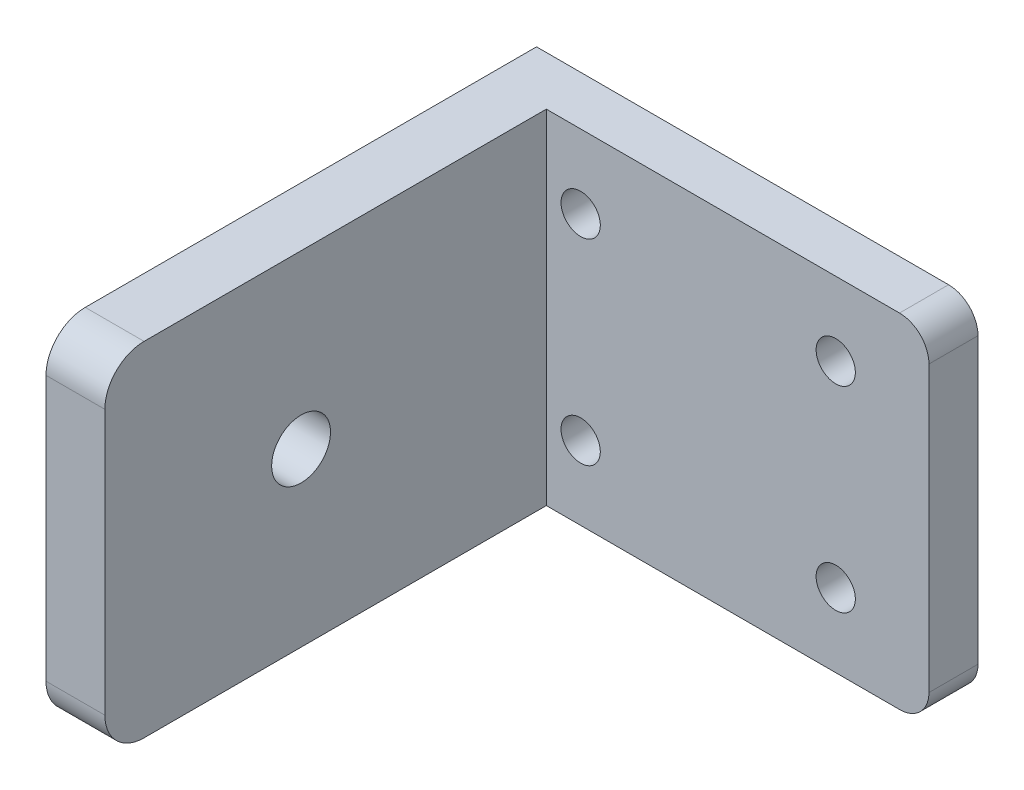
from build123d import *

# Parameters (mm, degrees)
SKETCH_1_W          = 45
SKETCH_1_H          = 35
EXTRUDE_1_DEPTH     = 5
SKETCH_2_W          = 6
SKETCH_2_H          = 35
EXTRUDE_2_DEPTH     = 45
SKETCH_3_R          = 3
CUT_EXTRUDE_1_DEPTH = 70.507193872
FILLET_1_R          = 3
FILLET_2_R          = 4
CUT_EXTRUDE_2_REACH = 59.554
SKETCH_4_R          = 2


with BuildPart() as part:
    # 草图1 → 凸台-拉伸1 (new body)
    with BuildSketch(Plane.XY):
        Rectangle(SKETCH_1_W, SKETCH_1_H)
    extrude(amount=EXTRUDE_1_DEPTH)

    # 草图2 → 凸台-拉伸2 (add)
    with BuildSketch(Plane.XY.offset(5)):
        with Locations((-19.5, 0)):
            Rectangle(SKETCH_2_W, SKETCH_2_H)
    extrude(amount=EXTRUDE_2_DEPTH)

    # 草图3 → 切除-拉伸1 (cut, through all)
    with BuildSketch(Plane.ZY.offset(22.5)):
        with Locations((30, 0)):
            Circle(SKETCH_3_R)
    extrude(amount=-CUT_EXTRUDE_1_DEPTH, mode=Mode.SUBTRACT)

    # 圆角1
    fillet_1_edges = [part.edges().sort_by_distance(p)[0] for p in [
        (22.5, -17.5, 2.5),
        (22.5, 17.5, 2.5),
    ]]
    fillet(fillet_1_edges, radius=FILLET_1_R)

    # 圆角2
    fillet_2_edges = [part.edges().sort_by_distance(p)[0] for p in [
        (-19.5, -17.5, 50),
        (-19.5, 17.5, 50),
    ]]
    fillet(fillet_2_edges, radius=FILLET_2_R)

    # 草图4 → 切除-拉伸2 (cut, up to next)
    with BuildSketch(Plane(origin=(0, 0, 0), x_dir=(-1, 0, 0), z_dir=(0, 0, -1)), mode=Mode.PRIVATE) as cut_extrude_2_sk1:
        with Locations((-13, 10)):
            Circle(SKETCH_4_R)
    cut_extrude_2_tool1 = extrude(cut_extrude_2_sk1.sketch, amount=-CUT_EXTRUDE_2_REACH, mode=Mode.PRIVATE) & part.part
    # 草图4 → 切除-拉伸2 (cut, up to next)
    with BuildSketch(Plane(origin=(0, 0, 0), x_dir=(-1, 0, 0), z_dir=(0, 0, -1)), mode=Mode.PRIVATE) as cut_extrude_2_sk2:
        with Locations((13, 10)):
            Circle(SKETCH_4_R)
    cut_extrude_2_tool2 = extrude(cut_extrude_2_sk2.sketch, amount=-CUT_EXTRUDE_2_REACH, mode=Mode.PRIVATE) & part.part
    # 草图4 → 切除-拉伸2 (cut, up to next)
    with BuildSketch(Plane(origin=(0, 0, 0), x_dir=(-1, 0, 0), z_dir=(0, 0, -1)), mode=Mode.PRIVATE) as cut_extrude_2_sk3:
        with Locations((13, -10)):
            Circle(SKETCH_4_R)
    cut_extrude_2_tool3 = extrude(cut_extrude_2_sk3.sketch, amount=-CUT_EXTRUDE_2_REACH, mode=Mode.PRIVATE) & part.part
    # 草图4 → 切除-拉伸2 (cut, up to next)
    with BuildSketch(Plane(origin=(0, 0, 0), x_dir=(-1, 0, 0), z_dir=(0, 0, -1)), mode=Mode.PRIVATE) as cut_extrude_2_sk4:
        with Locations((-13, -10)):
            Circle(SKETCH_4_R)
    cut_extrude_2_tool4 = extrude(cut_extrude_2_sk4.sketch, amount=-CUT_EXTRUDE_2_REACH, mode=Mode.PRIVATE) & part.part
    add(cut_extrude_2_tool1.solids().sort_by_distance((13, 10, 0))[0], mode=Mode.SUBTRACT)
    add(cut_extrude_2_tool2.solids().sort_by_distance((-13, 10, 0))[0], mode=Mode.SUBTRACT)
    add(cut_extrude_2_tool3.solids().sort_by_distance((-13, -10, 0))[0], mode=Mode.SUBTRACT)
    add(cut_extrude_2_tool4.solids().sort_by_distance((13, -10, 0))[0], mode=Mode.SUBTRACT)


solid = part.part
